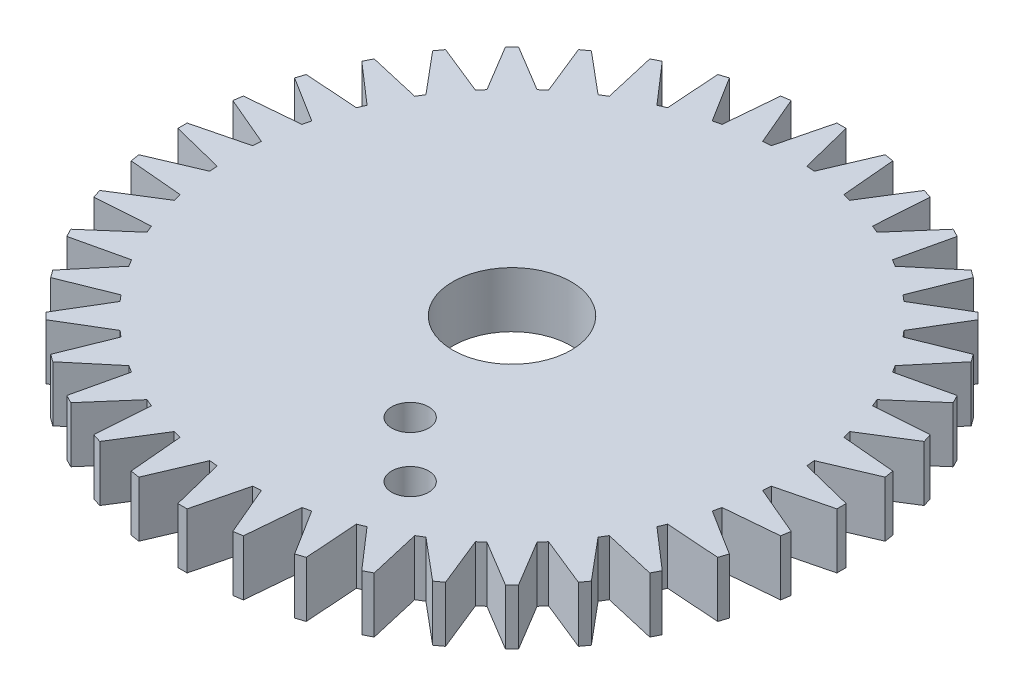
from build123d import *

# Parameters (mm, degrees)
SKETCH1_R           = 15
BOSS_EXTRUDE1_DEPTH = 3
BOSS_EXTRUDE2_DEPTH = 3
CIRPATTERN1_COUNT   = 40
SKETCH4_R           = 3.2
CUT_EXTRUDE1_DEPTH  = 3
SKETCH5_R           = 1
CUT_EXTRUDE2_DEPTH  = 3


with BuildPart() as part:
    # Sketch1 → Boss-Extrude1 (new body)
    with BuildSketch(Plane(origin=(0, 0, 0), x_dir=(1, 0, 0), z_dir=(0, 1, 0))):
        with Locations(Location((0, 0, 0), (0, 0, 270))):
            Circle(SKETCH1_R)
    extrude(amount=BOSS_EXTRUDE1_DEPTH)

    # Sketch3 → Boss-Extrude2 (add)
    with BuildSketch(Plane(origin=(0, 3, 0), x_dir=(1, 0, 0), z_dir=(0, 1, 0))):
        Polygon((-1, 14.8), (-0.25, 17.8), (0.25, 17.8), (1, 14.8), align=None)
    boss_extrude2 = extrude(amount=-BOSS_EXTRUDE2_DEPTH)

    # CirPattern1: Boss-Extrude2 ×40 about axis
    cirpattern1_axis = Axis((0, 0, 0), (0, 1, 0))
    for i in range(1, CIRPATTERN1_COUNT):
        add(boss_extrude2.rotate(cirpattern1_axis, i * 360 / CIRPATTERN1_COUNT))

    # Sketch4 → Cut-Extrude1 (cut)
    with BuildSketch(Plane(origin=(0, 3, 0), x_dir=(1, 0, 0), z_dir=(0, 1, 0))):
        with Locations(Location((0, 0, 0), (0, 0, 270))):
            Circle(SKETCH4_R)
    extrude(amount=-CUT_EXTRUDE1_DEPTH, mode=Mode.SUBTRACT)

    # Sketch5 → Cut-Extrude2 (cut)
    with BuildSketch(Plane(origin=(0, 3, 0), x_dir=(1, 0, 0), z_dir=(0, 1, 0))):
        with Locations(Location((2, -7.5, 0), (0, 0, 270))):
            Circle(SKETCH5_R)
        with Locations(Location((5, -10.5, 0), (0, 0, 270))):
            Circle(SKETCH5_R)
    extrude(amount=-CUT_EXTRUDE2_DEPTH, mode=Mode.SUBTRACT)


solid = part.part
